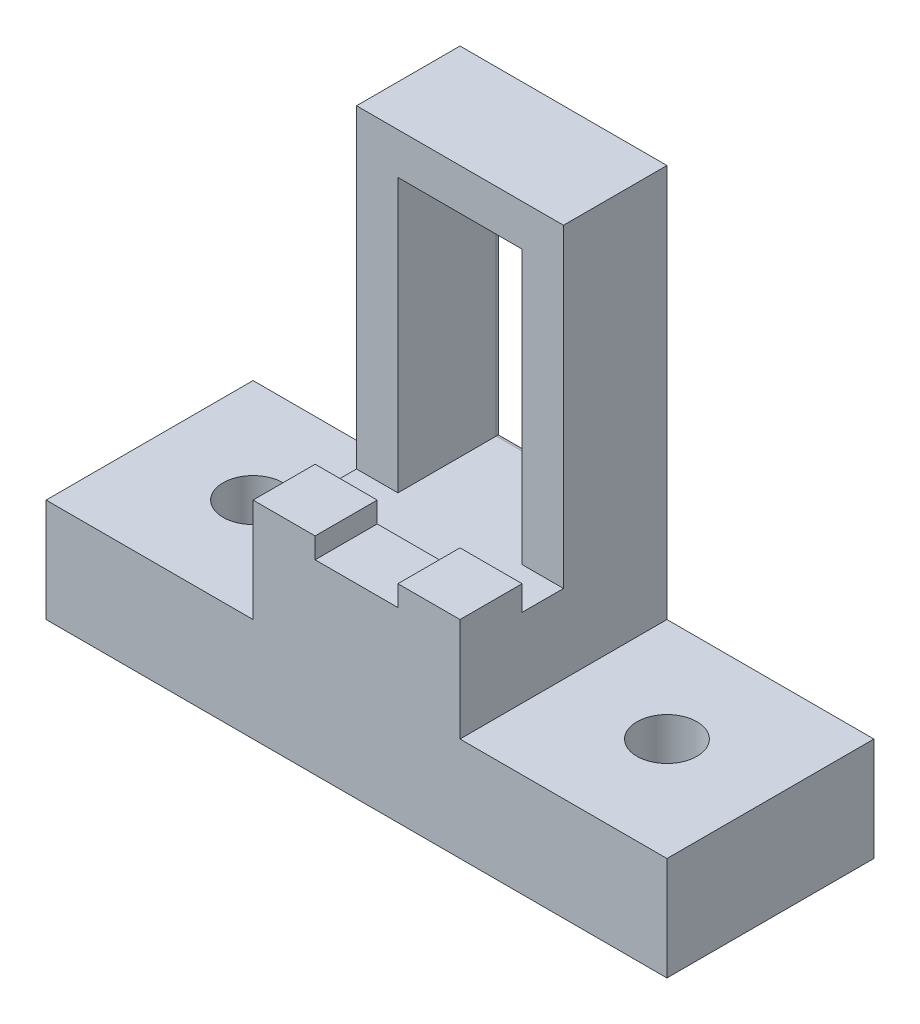
from build123d import *

# Parameters (mm, degrees)
EXTRUDE_1_DEPTH     = 4
SKETCH_2_W          = 10
SKETCH_2_H          = 15
EXTRUDE_2_DEPTH     = 20
SKETCH_3_R          = 1.45
CUT_EXTRUDE_1_DEPTH = 20
SKETCH_4_W          = 6
SKETCH_4_H          = 13.2
CUT_EXTRUDE_2_DEPTH = 9.5
SKETCH_6_R          = 0.75
CUT_EXTRUDE_4_DEPTH = 3.5
SKETCH_7_W          = 10
SKETCH_7_H          = 24
CUT_EXTRUDE_5_DEPTH = 5
SKETCH_9_W          = 3
SKETCH_9_H          = 12
CUT_EXTRUDE_6_DEPTH = 10
SKETCH_11_W         = 1.5
SKETCH_11_H         = 12
CUT_EXTRUDE_7_DEPTH = 10
CUT_EXTRUDE_8_REACH = 41.699
SKETCH_13_W         = 10
SKETCH_13_H         = 5
SKETCH_19_W         = 10
SKETCH_19_H         = 2.4
EXTRUDE_6_DEPTH     = 4.8
SKETCH_20_W         = 10
SKETCH_20_H         = 2.6
EXTRUDE_7_DEPTH     = 6
FILLET_17_R         = 0.25
SKETCH_21_W         = 4
SKETCH_21_H         = 1
CUT_EXTRUDE_9_DEPTH = 5.2
EXTRUDE_8_DEPTH     = 0.4
EXTRUDE_START       = 1
SKETCH_29_W         = 10
SKETCH_29_H         = 10
SKETCH_29_R         = 1.45
EXTRUDE_9_DEPTH     = 1


with BuildPart() as part:
    # 草图1 → 凸台-拉伸1 (new body)
    with BuildSketch(Plane(origin=(0, 0, 0), x_dir=(1, 0, 0), z_dir=(0, 1, 0))):
        Polygon((-20, 0), (-20, -5), (-10, -5), (-10, 0), (0, 0), (0, 10), (-30, 10), (-30, 0), align=None)
    extrude(amount=EXTRUDE_1_DEPTH)

    # 草图2 → 凸台-拉伸2 (add)
    with BuildSketch(Plane(origin=(0, 4, 0), x_dir=(1, 0, 0), z_dir=(0, 1, 0))):
        with Locations((-15, 2.5)):
            Rectangle(SKETCH_2_W, SKETCH_2_H)
    extrude(amount=EXTRUDE_2_DEPTH)

    # 草图3 → 切除-拉伸1 (cut)
    with BuildSketch(Plane(origin=(0, 4, 0), x_dir=(1, 0, 0), z_dir=(0, 1, 0))):
        with Locations(Location((-25, 5, 0), (0, 0, 270))):
            Circle(SKETCH_3_R)
        with Locations(Location((-5, 5, 0), (0, 0, 270))):
            Circle(SKETCH_3_R)
    extrude(amount=-CUT_EXTRUDE_1_DEPTH, mode=Mode.SUBTRACT)

    # 草图4 → 切除-拉伸2 (cut)
    with BuildSketch(Plane(origin=(0, 0, -10), x_dir=(-1, 0, 0), z_dir=(0, 0, -1))):
        with Locations((15, 15.4)):
            Rectangle(SKETCH_4_W, SKETCH_4_H)
    extrude(amount=-CUT_EXTRUDE_2_DEPTH, mode=Mode.SUBTRACT)

    # 草图6 → 切除-拉伸4 (cut)
    with BuildSketch(Plane(origin=(0, 0, -0.5), x_dir=(-1, 0, 0), z_dir=(0, 0, -1))):
        with Locations((15, 20.68)):
            Circle(SKETCH_6_R)
        with Locations((15, 10.52)):
            Circle(SKETCH_6_R)
        with Locations((15, 15.6)):
            Circle(SKETCH_6_R)
    extrude(amount=-CUT_EXTRUDE_4_DEPTH, mode=Mode.SUBTRACT)

    # 草图7 → 切除-拉伸5 (cut)
    with BuildSketch(Plane.XY.offset(5)):
        with Locations((-15, 12)):
            Rectangle(SKETCH_7_W, SKETCH_7_H)
    extrude(amount=-CUT_EXTRUDE_5_DEPTH, mode=Mode.SUBTRACT)

    # 草图9 → 切除-拉伸6 (cut)
    with BuildSketch(Plane(origin=(0, 0, -0.5), x_dir=(-1, 0, 0), z_dir=(0, 0, -1))):
        with Locations((15, 15.6)):
            Rectangle(SKETCH_9_W, SKETCH_9_H)
    extrude(amount=-CUT_EXTRUDE_6_DEPTH, mode=Mode.SUBTRACT)

    # 草图11 → 切除-拉伸7 (cut)
    with BuildSketch(Plane(origin=(0, 0, -0.5), x_dir=(-1, 0, 0), z_dir=(0, 0, -1))):
        with Locations((17.25, 15.6)):
            Rectangle(SKETCH_11_W, SKETCH_11_H)
        with Locations((12.75, 15.6)):
            Rectangle(SKETCH_11_W, SKETCH_11_H)
    extrude(amount=-CUT_EXTRUDE_7_DEPTH, mode=Mode.SUBTRACT)

    # 切除-拉伸8: up to this face of the body (flat: up to its plane)
    cut_extrude_8_end = Plane(part.part.faces().sort_by_distance((-5, 4, -9.858578644))[0])
    # 草图13 → 切除-拉伸8 (cut, up to the picked face)
    with BuildSketch(Plane(origin=(0, 24, 0), x_dir=(1, 0, 0), z_dir=(0, 1, 0)), mode=Mode.PRIVATE) as cut_extrude_8_sk1:
        with Locations((-15, 2.5)):
            Rectangle(SKETCH_13_W, SKETCH_13_H)
    cut_extrude_8_tool1 = split(extrude(cut_extrude_8_sk1.sketch, amount=-CUT_EXTRUDE_8_REACH, mode=Mode.PRIVATE), bisect_by=cut_extrude_8_end, keep=Keep.BOTH, mode=Mode.PRIVATE)
    add(cut_extrude_8_tool1.solids().sort_by(Axis((-15, 24, -2.5), (0, -1, 0)))[0], mode=Mode.SUBTRACT)

    # 草图19 → 凸台-拉伸6 (add)
    with BuildSketch(Plane(origin=(0, 4, 0), x_dir=(1, 0, 0), z_dir=(0, 1, 0))):
        with Locations((-15, 3.8)):
            Rectangle(SKETCH_19_W, SKETCH_19_H)
    extrude(amount=EXTRUDE_6_DEPTH)

    # 草图20 → 凸台-拉伸7 (add)
    with BuildSketch(Plane(origin=(0, 4, 0), x_dir=(1, 0, 0), z_dir=(0, 1, 0))):
        with Locations((-15, 1.3)):
            Rectangle(SKETCH_20_W, SKETCH_20_H)
    extrude(amount=EXTRUDE_7_DEPTH)

    # 圆角17
    fillet_17_edges = [part.edges().sort_by_distance(p)[0] for p in [
        (-12, 15.4, -10),
        (-15, 8.8, -10),
        (-18, 15.4, -10),
        (-15, 22, -10),
    ]]
    fillet(fillet_17_edges, radius=FILLET_17_R)

    # 草图21 → 切除-拉伸9 (cut)
    with BuildSketch(Plane.XY):
        with Locations((-15, 9.5)):
            Rectangle(SKETCH_21_W, SKETCH_21_H)
    extrude(amount=-CUT_EXTRUDE_9_DEPTH, mode=Mode.SUBTRACT)

    # 草图22 → 凸台-拉伸8 (add)
    with BuildSketch(Plane(origin=(0, 0, -2.6), x_dir=(-1, 0, 0), z_dir=(0, 0, -1))):
        Polygon((17, 9), (13, 9), (13, 10), (10, 10), (10, 8.8), (20, 8.8), (20, 10), (17, 10), align=None)
    extrude(amount=EXTRUDE_8_DEPTH)

    # 草图29 → 凸台-拉伸9 (add)
    # profile 1 of 2: a face of its own
    with BuildSketch(Plane(origin=(0, 4, 0), x_dir=(1, 0, 0), z_dir=(0, 1, 0)).offset(EXTRUDE_START)):
        with Locations((-25, 5)):
            Rectangle(SKETCH_29_W, SKETCH_29_H)
        with Locations(Location((-25, 5, 0), (0, 0, 270))):
            Circle(SKETCH_29_R, mode=Mode.SUBTRACT)
    # profile 2 of 2: a face of its own
    with BuildSketch(Plane(origin=(0, 4, 0), x_dir=(1, 0, 0), z_dir=(0, 1, 0)).offset(EXTRUDE_START)):
        with Locations((-5, 5)):
            Rectangle(SKETCH_29_W, SKETCH_29_H)
        with Locations(Location((-5, 5, 0), (0, 0, 270))):
            Circle(SKETCH_29_R, mode=Mode.SUBTRACT)
    extrude(amount=-EXTRUDE_9_DEPTH)


solid = part.part
